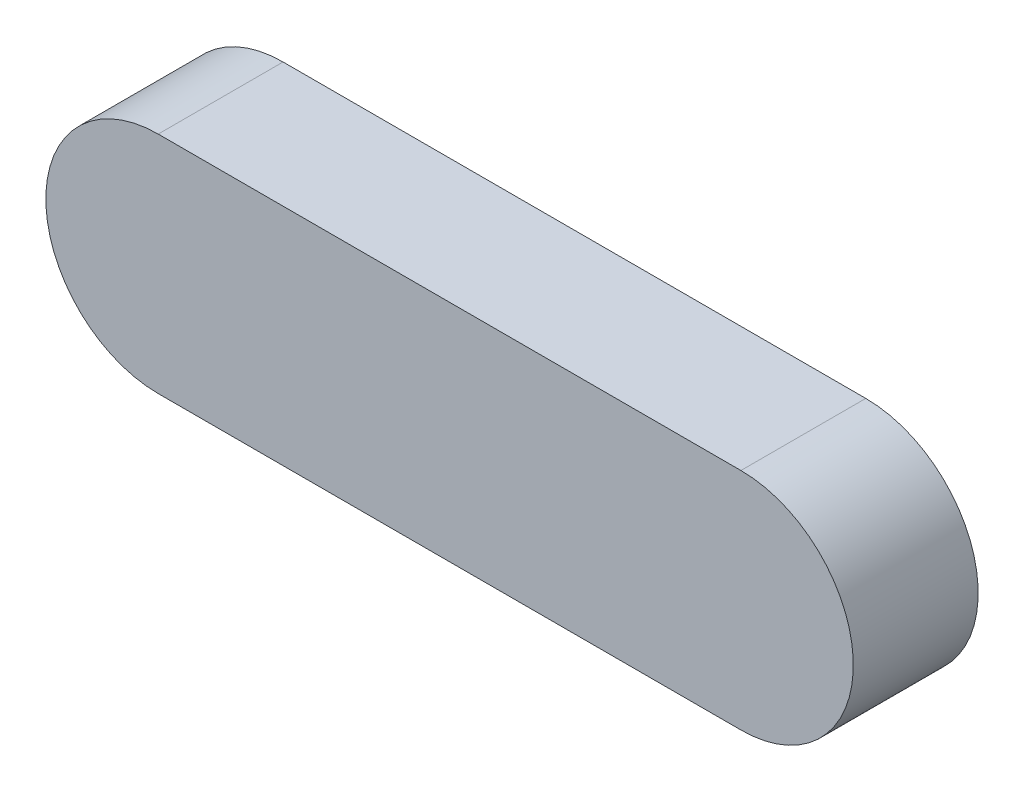
from build123d import *

# Parameters (mm, degrees)
EXTRUDE1_DEPTH = 15
SKETCH2_R      = 10
EXTRUDE2_DEPTH = 10


with BuildPart() as part:
    # Sketch1 → Extrude1 (new body)
    with BuildSketch(Plane.XY):
        with BuildLine():
            Line((50, 198.565015772), (-20, 198.565015772))
            ThreePointArc((-20, 198.565015772), (-33.5, 212.065015772), (-20, 225.565015772))
            Line((-20, 225.565015772), (50, 225.565015772))
            ThreePointArc((50, 225.565015772), (63.5, 212.065015772), (50, 198.565015772))
        make_face()
    extrude(amount=EXTRUDE1_DEPTH)

    # Sketch2 → Extrude2 (cut)
    with BuildSketch(Plane(origin=(0, 0, 0), x_dir=(-1, 0, 0), z_dir=(0, 0, -1))):
        with Locations((-15, 212.065015772)):
            Circle(SKETCH2_R)
    extrude(amount=-EXTRUDE2_DEPTH, mode=Mode.SUBTRACT)


solid = part.part
